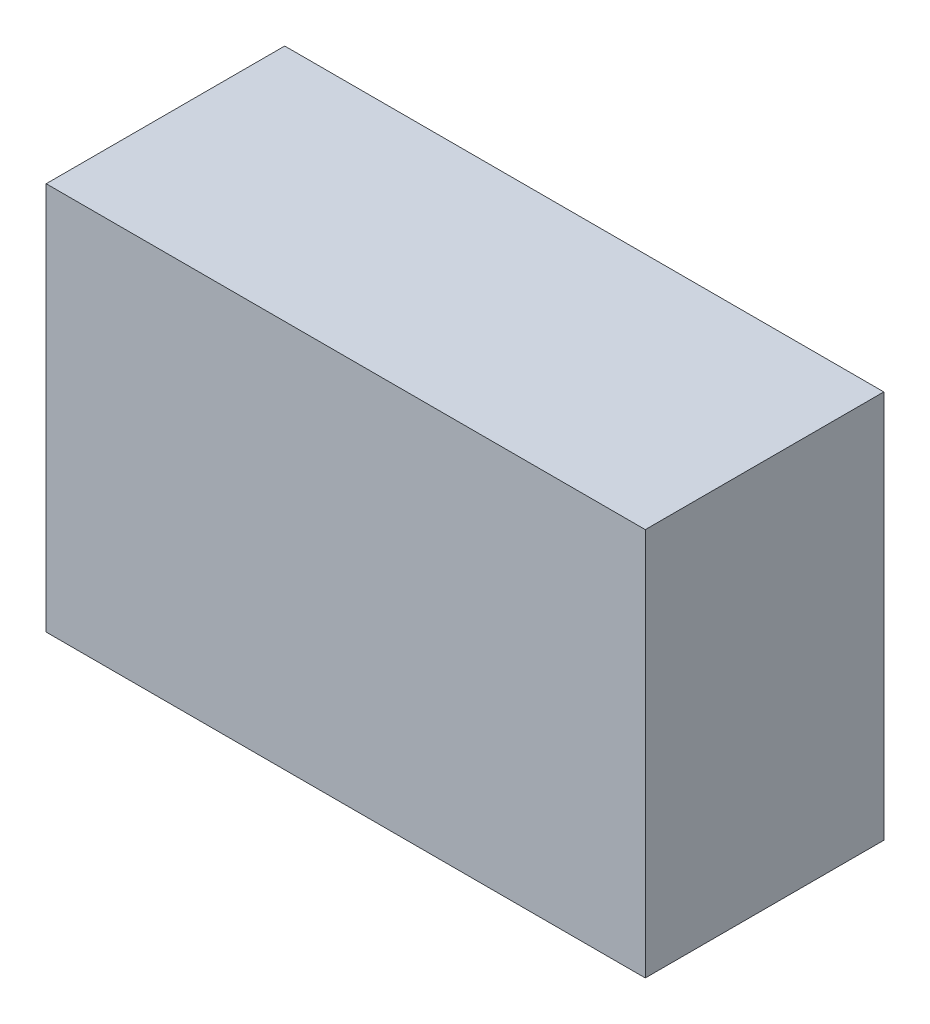
from build123d import *

# Parameters (mm, degrees)
SKETCH_1_W      = 54
SKETCH_1_H      = 35
EXTRUDE_1_DEPTH = 21.5


with BuildPart() as part:
    # ｽｹｯﾁ1 → ﾎﾞｽ - 押し出し1 (new body)
    with BuildSketch(Plane.XY):
        Rectangle(SKETCH_1_W, SKETCH_1_H)
    extrude(amount=EXTRUDE_1_DEPTH)


solid = part.part
